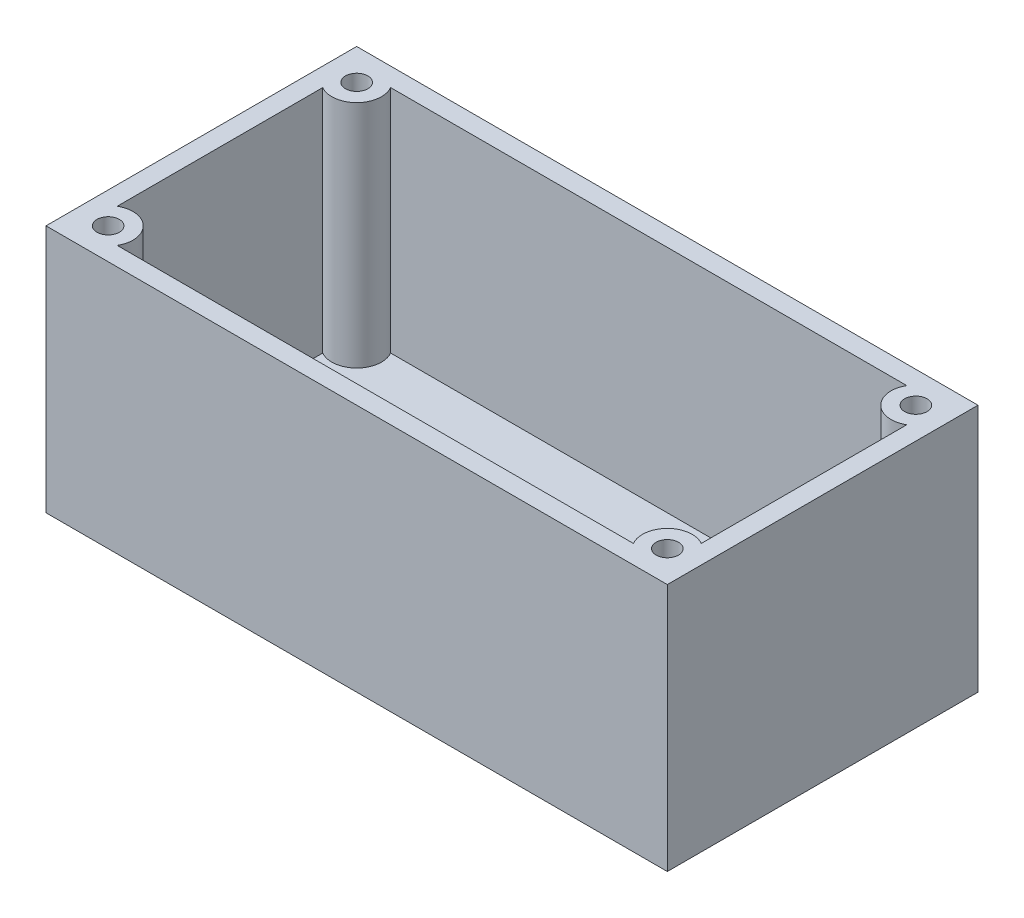
from build123d import *

# Parameters (mm, degrees)
SKETCH_1_W      = 50
SKETCH_1_H      = 25
EXTRUDE_1_DEPTH = 20
SHELL_1_T       = -1.5
SKETCH_1_3_R    = 2
SKETCH_1_3_R_2  = 0.9
EXTRUDE_2_DEPTH = 20


with BuildPart() as part:
    # 草图1 → 凸台-拉伸1 (new body)
    with BuildSketch(Plane(origin=(0, 0, 0), x_dir=(1, 0, 0), z_dir=(0, 1, 0))):
        with Locations((25, 12.5)):
            Rectangle(SKETCH_1_W, SKETCH_1_H)
    extrude(amount=EXTRUDE_1_DEPTH)

    # 抽壳1
    shell_1_openings = [part.faces().sort_by_distance(p)[0] for p in [
        (25, 20, -12.5),
    ]]
    offset(amount=SHELL_1_T, openings=shell_1_openings, kind=Kind.INTERSECTION)

    # 草图1<3> → 凸台-拉伸2 (add)
    # profile 1 of 4: a face of its own
    with BuildSketch(Plane(origin=(0, 0, 0), x_dir=(1, 0, 0), z_dir=(0, 1, 0))):
        with Locations((2.5, 22.5)):
            Circle(SKETCH_1_3_R)
        with Locations((2.5, 22.5)):
            Circle(SKETCH_1_3_R_2, mode=Mode.SUBTRACT)
    # profile 2 of 4: a face of its own
    with BuildSketch(Plane(origin=(0, 0, 0), x_dir=(1, 0, 0), z_dir=(0, 1, 0))):
        with Locations((47.5, 22.5)):
            Circle(SKETCH_1_3_R)
        with Locations((47.5, 22.5)):
            Circle(SKETCH_1_3_R_2, mode=Mode.SUBTRACT)
    # profile 3 of 4: a face of its own
    with BuildSketch(Plane(origin=(0, 0, 0), x_dir=(1, 0, 0), z_dir=(0, 1, 0))):
        with Locations((47.5, 2.5)):
            Circle(SKETCH_1_3_R)
        with Locations((47.5, 2.5)):
            Circle(SKETCH_1_3_R_2, mode=Mode.SUBTRACT)
    # profile 4 of 4: a face of its own
    with BuildSketch(Plane(origin=(0, 0, 0), x_dir=(1, 0, 0), z_dir=(0, 1, 0))):
        with Locations((2.5, 2.5)):
            Circle(SKETCH_1_3_R)
        with Locations((2.5, 2.5)):
            Circle(SKETCH_1_3_R_2, mode=Mode.SUBTRACT)
    extrude(amount=EXTRUDE_2_DEPTH)


solid = part.part
